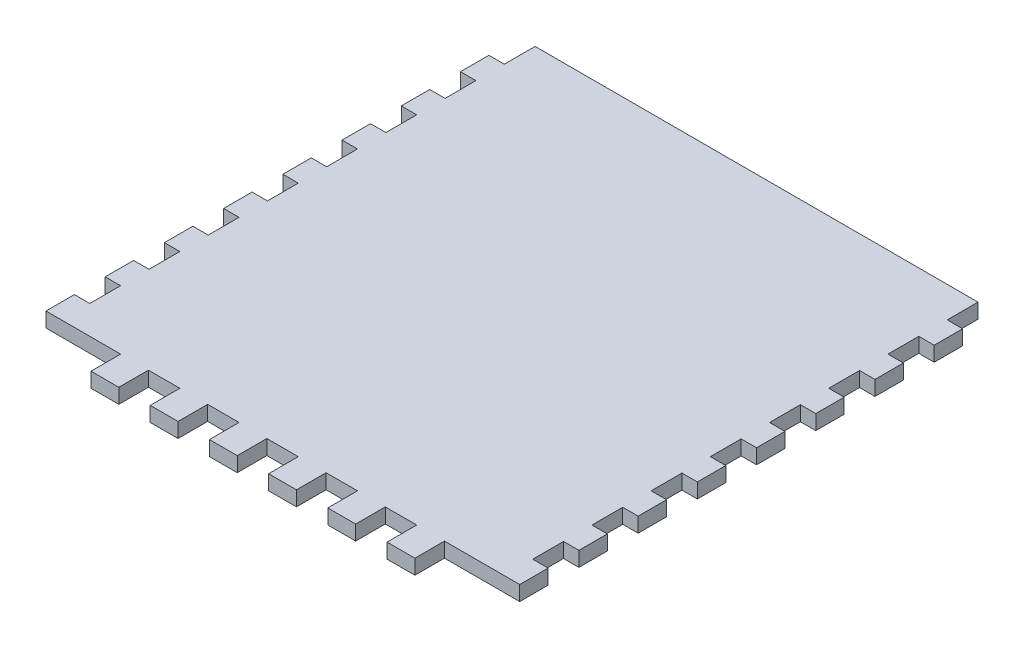
from build123d import *

# Parameters (mm, degrees)
SKETCH1_W           = 101.6
SKETCH1_H           = 107.95
BOSS_EXTRUDE1_DEPTH = 3.175
SKETCH2_W           = 3.302
SKETCH2_H           = 6.604
CUT_EXTRUDE1_DEPTH  = 75.189091179


with BuildPart() as part:
    # Sketch1 → Boss-Extrude1 (new body)
    with BuildSketch(Plane(origin=(0, 0, 0), x_dir=(1, 0, 0), z_dir=(0, 1, 0))):
        Rectangle(SKETCH1_W, SKETCH1_H)
    extrude(amount=BOSS_EXTRUDE1_DEPTH)

    # Sketch2 → Cut-Extrude1 (cut, through all)
    with BuildSketch(Plane.XZ):
        Polygon((-34.798, 47.625), (-47.498, 47.625), (-50.8, 47.625), (-50.8, 54.229), (-50.8, 63.03162391), (50.8, 63.03162391), (50.8, 54.229), (50.8, 47.625), (47.498, 47.625), (34.671, 47.625), (34.671, 54.229), (28.702, 54.229), (28.702, 47.625), (21.971, 47.625), (21.971, 54.229), (16.002, 54.229), (16.002, 47.625), (9.271, 47.625), (9.271, 54.229), (3.302, 54.229), (3.302, 47.625), (-3.429, 47.625), (-3.429, 54.229), (-9.398, 54.229), (-9.398, 47.625), (-16.129, 47.625), (-16.129, 54.229), (-22.098, 54.229), (-22.098, 47.625), (-28.829, 47.625), (-28.829, 54.229), (-34.798, 54.229), align=None)
        with Locations((49.149, 38.227)):
            Rectangle(SKETCH2_W, SKETCH2_H)
        with Locations((49.149, 25.527)):
            Rectangle(SKETCH2_W, SKETCH2_H)
        with Locations((49.149, 12.827)):
            Rectangle(SKETCH2_W, SKETCH2_H)
        with Locations((49.149, 0.127)):
            Rectangle(SKETCH2_W, SKETCH2_H)
        with Locations((49.149, -12.573)):
            Rectangle(SKETCH2_W, SKETCH2_H)
        with Locations((49.149, -25.273)):
            Rectangle(SKETCH2_W, SKETCH2_H)
        with Locations((49.149, -37.973)):
            Rectangle(SKETCH2_W, SKETCH2_H)
        with Locations((-49.149, -37.973)):
            Rectangle(SKETCH2_W, SKETCH2_H)
        with Locations((-49.149, -25.273)):
            Rectangle(SKETCH2_W, SKETCH2_H)
        with Locations((-49.149, -12.573)):
            Rectangle(SKETCH2_W, SKETCH2_H)
        with Locations((-49.149, 0.127)):
            Rectangle(SKETCH2_W, SKETCH2_H)
        with Locations((-49.149, 12.827)):
            Rectangle(SKETCH2_W, SKETCH2_H)
        with Locations((-49.149, 25.527)):
            Rectangle(SKETCH2_W, SKETCH2_H)
        with Locations((-49.149, 38.227)):
            Rectangle(SKETCH2_W, SKETCH2_H)
        with Locations((49.149, -50.673)):
            Rectangle(SKETCH2_W, SKETCH2_H)
        with Locations((-49.149, -50.673)):
            Rectangle(SKETCH2_W, SKETCH2_H)
    extrude(amount=-CUT_EXTRUDE1_DEPTH, mode=Mode.SUBTRACT)


solid = part.part
